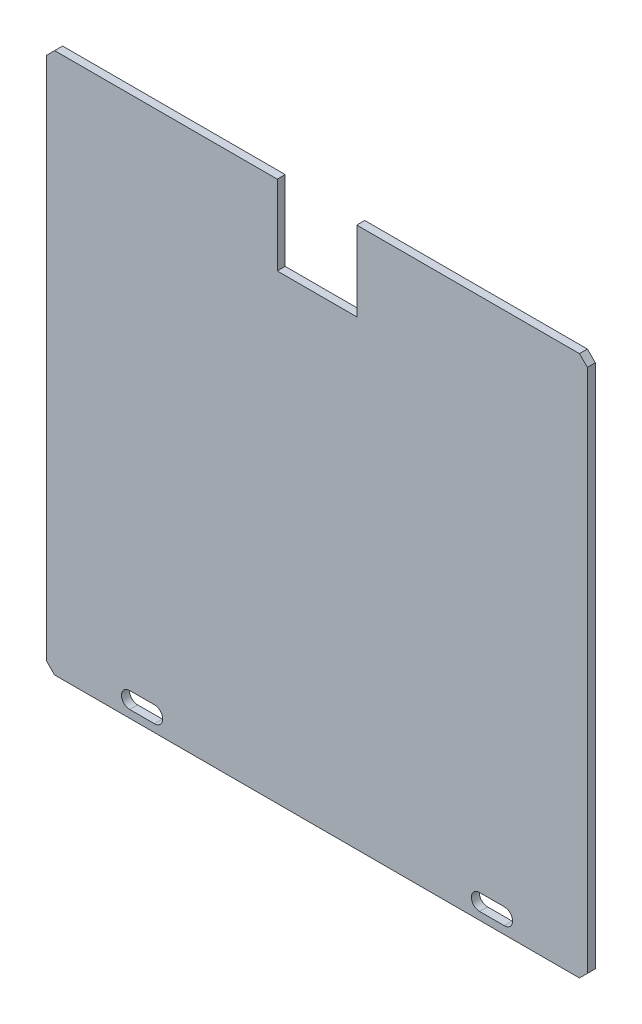
from build123d import *

# Parameters (mm, degrees)
SKETCH2_W           = 340
SKETCH2_H           = 340
BOSS_EXTRUDE1_DEPTH = 5
CHAMFER1_SIZE       = 5
CUT_EXTRUDE2_DEPTH  = 241.468293128
SKETCH5_W           = 50
SKETCH5_H           = 50
CUT_EXTRUDE3_DEPTH  = 241.468293128


with BuildPart() as part:
    # Sketch2 → Boss-Extrude1 (new body)
    with BuildSketch(Plane.XY):
        Rectangle(SKETCH2_W, SKETCH2_H)
    extrude(amount=BOSS_EXTRUDE1_DEPTH)

    # Chamfer1
    chamfer1_edges = [part.edges().sort_by_distance(p)[0] for p in [
        (170, -170, 2.5),
        (-170, -170, 2.5),
        (-170, 170, 2.5),
        (170, 170, 2.5),
    ]]
    chamfer(chamfer1_edges, length=CHAMFER1_SIZE)

    # Sketch4 → Cut-Extrude2 (cut, through all)
    with BuildSketch(Plane.XY.offset(5)):
        with BuildLine():
            Line((-7.8, 164.9), (7.8, 164.9))
            ThreePointArc((7.8, 164.9), (12.7, 160), (7.8, 155.1))
            Line((7.8, 155.1), (-7.8, 155.1))
            ThreePointArc((-7.8, 155.1), (-12.7, 160), (-7.8, 164.9))
        make_face()
        with BuildLine():
            Line((-117.8, -154.85), (-102.2, -154.85))
            ThreePointArc((-102.2, -154.85), (-97.05, -160), (-102.2, -165.15))
            Line((-102.2, -165.15), (-117.8, -165.15))
            ThreePointArc((-117.8, -165.15), (-122.95, -160), (-117.8, -154.85))
        make_face()
    cut_extrude2 = extrude(amount=-CUT_EXTRUDE2_DEPTH, mode=Mode.SUBTRACT)

    # Mirror1: Cut-Extrude2 across plane
    add(cut_extrude2.mirror(Plane(origin=(0, 0, 0), x_dir=(0, 0, 1), z_dir=(1, 0, 0))), mode=Mode.SUBTRACT)

    # Sketch5 → Cut-Extrude3 (cut, through all)
    with BuildSketch(Plane.XY.offset(5)):
        with Locations((0, 145)):
            Rectangle(SKETCH5_W, SKETCH5_H)
    extrude(amount=-CUT_EXTRUDE3_DEPTH, mode=Mode.SUBTRACT)


solid = part.part
